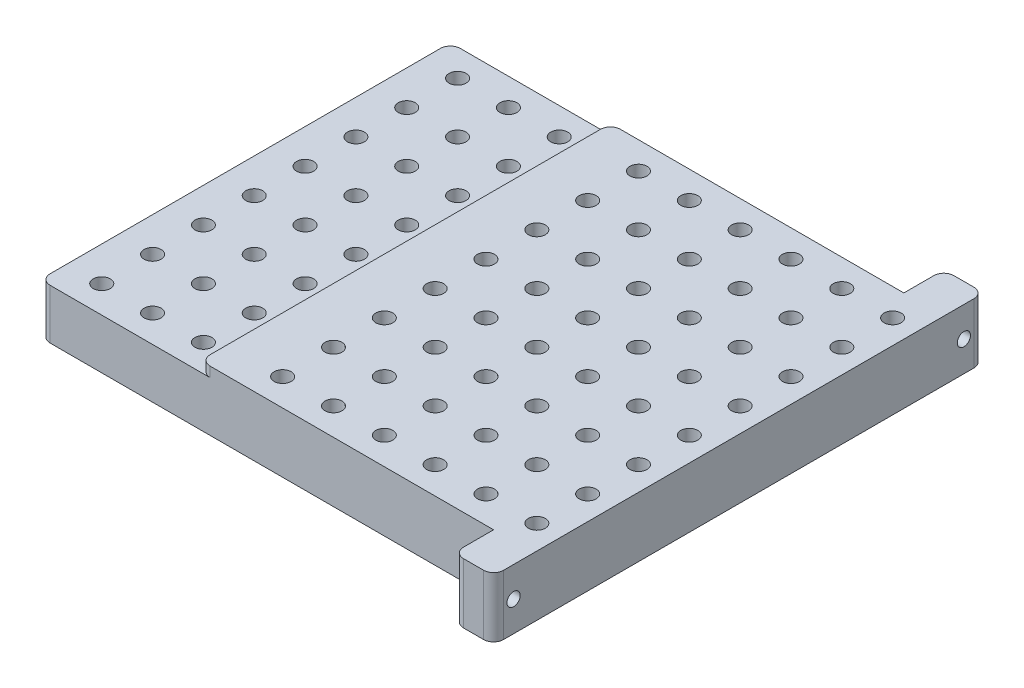
from build123d import *

# Parameters (mm, degrees)
BOSS_EXTRUDE1_DEPTH  = 205
M8_CLEARANCE_HOLE1_D = 8.5
FILLET1_R            = 5
SKETCH5_W            = 20
SKETCH5_H            = 30
BOSS_EXTRUDE2_DEPTH  = 20
SKETCH7_R            = 3.3
CUT_EXTRUDE1_DEPTH   = 20
FILLET2_R            = 5


with BuildPart() as part:
    # Sketch1 → Boss-Extrude1 (new body)
    with BuildSketch(Plane.XY):
        Polygon((-80, 0), (0, 0), (0, 5), (166.6, 5), (166.6, -25), (-80, -25), align=None)
    extrude(amount=BOSS_EXTRUDE1_DEPTH)

    # M8 Clearance Hole1 (through all)
    with Locations(Plane(origin=(0, 5, 0), x_dir=(1, 0, 0), z_dir=(0, 1, 0))):
        with Locations((-12, -13.6), (-62.8, -13.6), (-113.6, -13.6), (-62.8, -64.4), (-113.6, -64.4), (-62.8, -115.2), (-113.6, -115.2), (-62.8, -166), (-113.6, -166), (-12, -64.4), (-12, -115.2), (-12, -166), (53, -13.6), (103.8, -13.6), (154.6, -13.6), (103.8, -64.4), (154.6, -64.4), (103.8, -115.2), (154.6, -115.2), (103.8, -166), (154.6, -166), (53, -64.4), (53, -115.2), (53, -166), (-62.8, -39), (-12, -39), (53, -39), (103.8, -39), (154.6, -39), (154.6, -89.8), (103.8, -89.8), (53, -89.8), (-12, -89.8), (-62.8, -89.8), (-62.8, -140.6), (-12, -140.6), (53, -140.6), (103.8, -140.6), (154.6, -140.6), (154.6, -191.4), (103.8, -191.4), (53, -191.4), (-12, -191.4), (-62.8, -191.4), (-37.4, -13.6), (-37.4, -64.4), (-37.4, -115.2), (-37.4, -166), (-37.4, -191.4), (-37.4, -39), (-37.4, -89.8), (-37.4, -140.6), (129.2, -13.6), (129.2, -64.4), (129.2, -115.2), (129.2, -166), (129.2, -39), (129.2, -89.8), (129.2, -140.6), (129.2, -191.4), (78.4, -13.6), (78.4, -64.4), (78.4, -115.2), (78.4, -166), (78.4, -39), (78.4, -89.8), (78.4, -140.6), (78.4, -191.4), (27.6, -13.6), (27.6, -64.4), (27.6, -115.2), (27.6, -166), (27.6, -39), (27.6, -89.8), (27.6, -140.6), (27.6, -191.4)):
            Hole(M8_CLEARANCE_HOLE1_D / 2)

    # Fillet1
    fillet1_edges = [part.edges().sort_by_distance(p)[0] for p in [
        (0, 2.5, 205),
        (-80, -12.5, 205),
        (0, 2.5, 0),
        (-80, -12.5, 0),
    ]]
    fillet(fillet1_edges, radius=FILLET1_R)

    # Sketch5 → Boss-Extrude2 (add)
    with BuildSketch(Plane.XY.offset(205)):
        with Locations((156.6, -10)):
            Rectangle(SKETCH5_W, SKETCH5_H)
    boss_extrude2 = extrude(amount=BOSS_EXTRUDE2_DEPTH)

    # Sketch7 → Cut-Extrude1 (cut)
    with BuildSketch(Plane.ZY.offset(-146.6)):
        with Locations((215, -10)):
            Circle(SKETCH7_R)
    cut_extrude1 = extrude(amount=-CUT_EXTRUDE1_DEPTH, mode=Mode.SUBTRACT)

    # Mirror1: Boss-Extrude2, Cut-Extrude1 across plane
    add(boss_extrude2.mirror(Plane.XY.offset(102.5)))
    add(cut_extrude1.mirror(Plane.XY.offset(102.5)), mode=Mode.SUBTRACT)

    # Fillet2
    fillet2_edges = [part.edges().sort_by_distance(p)[0] for p in [
        (166.6, -10, 225),
        (146.6, -10, 225),
        (166.6, -10, -20),
        (146.6, -10, -20),
    ]]
    fillet(fillet2_edges, radius=FILLET2_R)


solid = part.part
